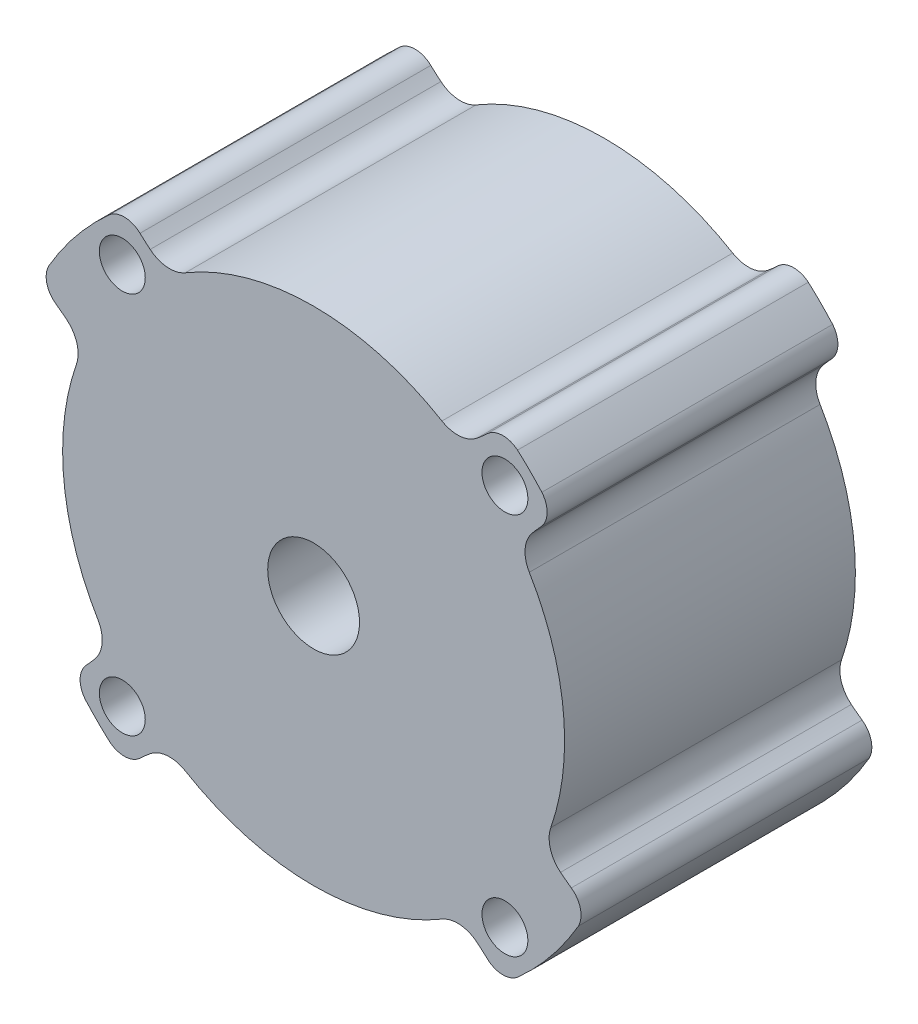
from build123d import *

# Parameters (mm, degrees)
SKETCH1_R               = 3
SKETCH1_R_2             = 1.5
SALIENTE_EXTRUIR1_DEPTH = 19
CROQUIS1_R              = 12.5
CORTAR_EXTRUIR1_DEPTH   = 2.5


with BuildPart() as part:
    # Sketch1 → Saliente-Extruir1 (new body)
    with BuildSketch(Plane.XY):
        with BuildLine():
            ThreePointArc((61.836197312, 3.286280309), (61.020411334, -3.741981398), (63.24135958, -10.459820208))
            ThreePointArc((63.24135958, -10.459820208), (63.516762306, -11.634828053), (63.06603659, -12.754353143))
            ThreePointArc((63.06603659, -12.754353143), (62.779959062, -13.090315668), (62.483190577, -13.416872916))
            ThreePointArc((62.483190577, -13.416872916), (62.077613071, -14.395673215), (62.420017601, -15.398320849))
            ThreePointArc((62.420017601, -15.398320849), (63.193255854, -16.216357175), (64.01129218, -16.989595428))
            ThreePointArc((64.01129218, -16.989595428), (65.013939814, -17.331999958), (65.992740113, -16.926422452))
            ThreePointArc((65.992740113, -16.926422452), (66.319297361, -16.629653967), (66.655259886, -16.343576439))
            ThreePointArc((66.655259886, -16.343576439), (67.774784976, -15.892850723), (68.949792821, -16.168253449))
            ThreePointArc((68.949792821, -16.168253449), (77.335391478, -18.474221551), (85.720990136, -16.168253449))
            ThreePointArc((85.720990136, -16.168253449), (86.89599798, -15.892850723), (88.01552307, -16.343576439))
            ThreePointArc((88.01552307, -16.343576439), (88.351485595, -16.629653967), (88.678042843, -16.926422452))
            ThreePointArc((88.678042843, -16.926422452), (89.656843143, -17.331999958), (90.659490776, -16.989595428))
            ThreePointArc((90.659490776, -16.989595428), (92.842363907, -14.704890816), (94.638151595, -12.104899113))
            ThreePointArc((94.638151595, -12.104899113), (94.770607573, -11.053709999), (94.175376931, -10.17721492))
            ThreePointArc((94.175376931, -10.17721492), (93.818673805, -9.917457245), (93.470537538, -9.646325709))
            ThreePointArc((93.470537538, -9.646325709), (92.802619494, -8.641151304), (92.834585645, -7.434723411))
            ThreePointArc((92.834585645, -7.434723411), (93.650371622, -0.406461703), (91.429423377, 6.311377107))
            ThreePointArc((91.429423377, 6.311377107), (91.154020651, 7.486384951), (91.604746367, 8.605910041))
            ThreePointArc((91.604746367, 8.605910041), (91.890823894, 8.941872566), (92.187592379, 9.268429814))
            ThreePointArc((92.187592379, 9.268429814), (92.593169886, 10.247230114), (92.250765355, 11.249877747))
            ThreePointArc((92.250765355, 11.249877747), (91.477527102, 12.067914073), (90.659490776, 12.841152326))
            ThreePointArc((90.659490776, 12.841152326), (89.656843142, 13.183556857), (88.678042843, 12.77797935))
            ThreePointArc((88.678042843, 12.77797935), (88.351485595, 12.481210865), (88.01552307, 12.195133338))
            ThreePointArc((88.01552307, 12.195133338), (86.89599798, 11.744407622), (85.720990135, 12.019810348))
            ThreePointArc((85.720990135, 12.019810348), (77.335391478, 14.325778449), (68.949792821, 12.019810348))
            ThreePointArc((68.949792821, 12.019810348), (67.774784976, 11.744407622), (66.655259886, 12.195133338))
            ThreePointArc((66.655259886, 12.195133338), (66.319297361, 12.481210865), (65.992740113, 12.77797935))
            ThreePointArc((65.992740113, 12.77797935), (65.013939814, 13.183556857), (64.01129218, 12.841152326))
            ThreePointArc((64.01129218, 12.841152326), (61.828419049, 10.556447714), (60.032631362, 7.956456011))
            ThreePointArc((60.032631362, 7.956456011), (59.900175383, 6.905266897), (60.495406025, 6.028771818))
            ThreePointArc((60.495406025, 6.028771818), (60.852109152, 5.769014143), (61.200245419, 5.497882608))
            ThreePointArc((61.200245419, 5.497882608), (61.868163462, 4.492708203), (61.836197312, 3.286280309))
        make_face()
        with Locations((77.335391478, -2.074221551)):
            Circle(SKETCH1_R, mode=Mode.SUBTRACT)
        with Locations((89.83539148, 10.425778451)):
            Circle(SKETCH1_R_2, mode=Mode.SUBTRACT)
        with Locations((64.835391477, 10.425778451)):
            Circle(SKETCH1_R_2, mode=Mode.SUBTRACT)
        with Locations((89.83539148, -14.574221552)):
            Circle(SKETCH1_R_2, mode=Mode.SUBTRACT)
        with Locations((64.835391477, -14.574221552)):
            Circle(SKETCH1_R_2, mode=Mode.SUBTRACT)
    extrude(amount=SALIENTE_EXTRUIR1_DEPTH)

    # Croquis1 → Cortar-Extruir1 (cut)
    with BuildSketch(Plane(origin=(0, 0, 0), x_dir=(-1, 0, 0), z_dir=(0, 0, -1))):
        with Locations((-77.335391478, -2.074221551)):
            Circle(CROQUIS1_R)
    extrude(amount=-CORTAR_EXTRUIR1_DEPTH, mode=Mode.SUBTRACT)


solid = part.part
